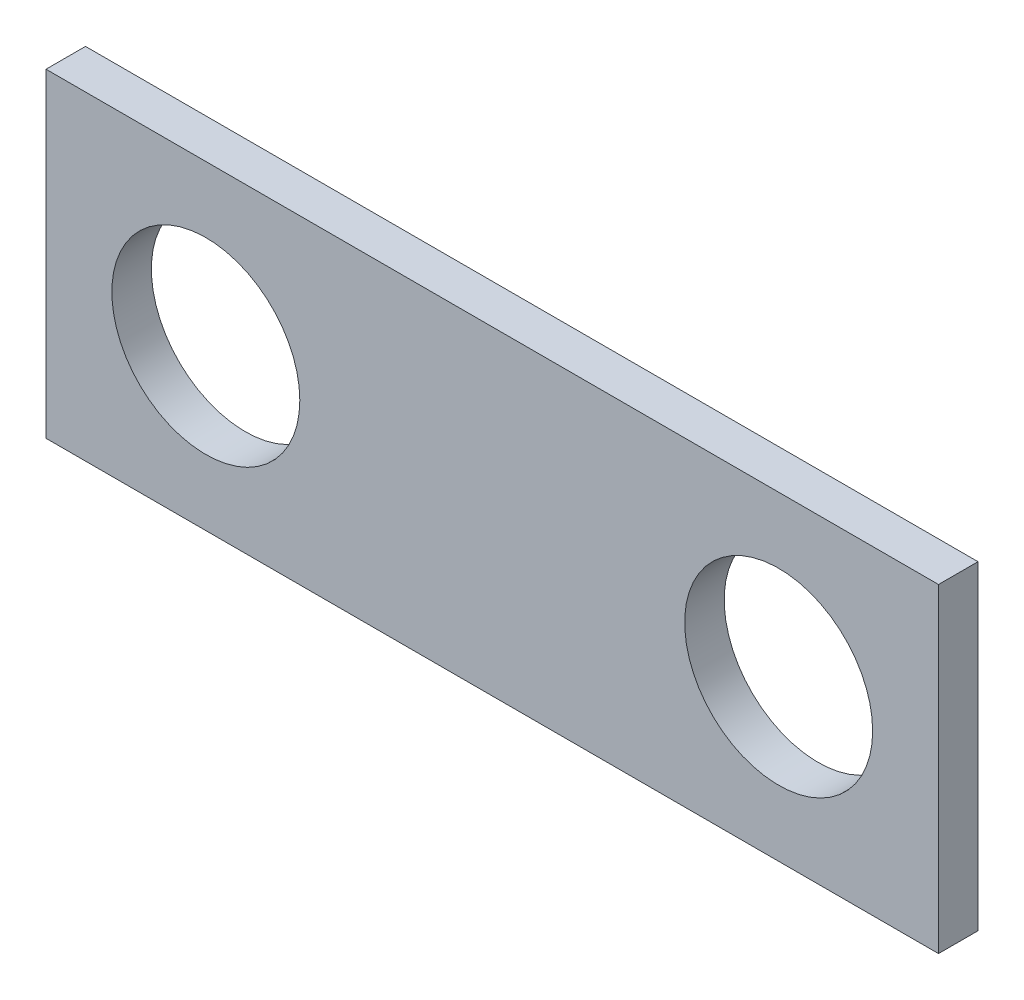
from build123d import *

# Parameters (mm, degrees)
SKETCH1_W           = 135.5496
SKETCH1_H           = 48.5496
SKETCH1_R           = 14.2748
BOSS_EXTRUDE1_DEPTH = 6


with BuildPart() as part:
    # Sketch1 → Boss-Extrude1 (new body)
    with BuildSketch(Plane.XY):
        with Locations((67.7748, 24.2748)):
            Rectangle(SKETCH1_W, SKETCH1_H)
        with Locations((24.2748, 24.2748)):
            Circle(SKETCH1_R, mode=Mode.SUBTRACT)
        with Locations((111.2748, 24.2748)):
            Circle(SKETCH1_R, mode=Mode.SUBTRACT)
    extrude(amount=BOSS_EXTRUDE1_DEPTH)


solid = part.part
